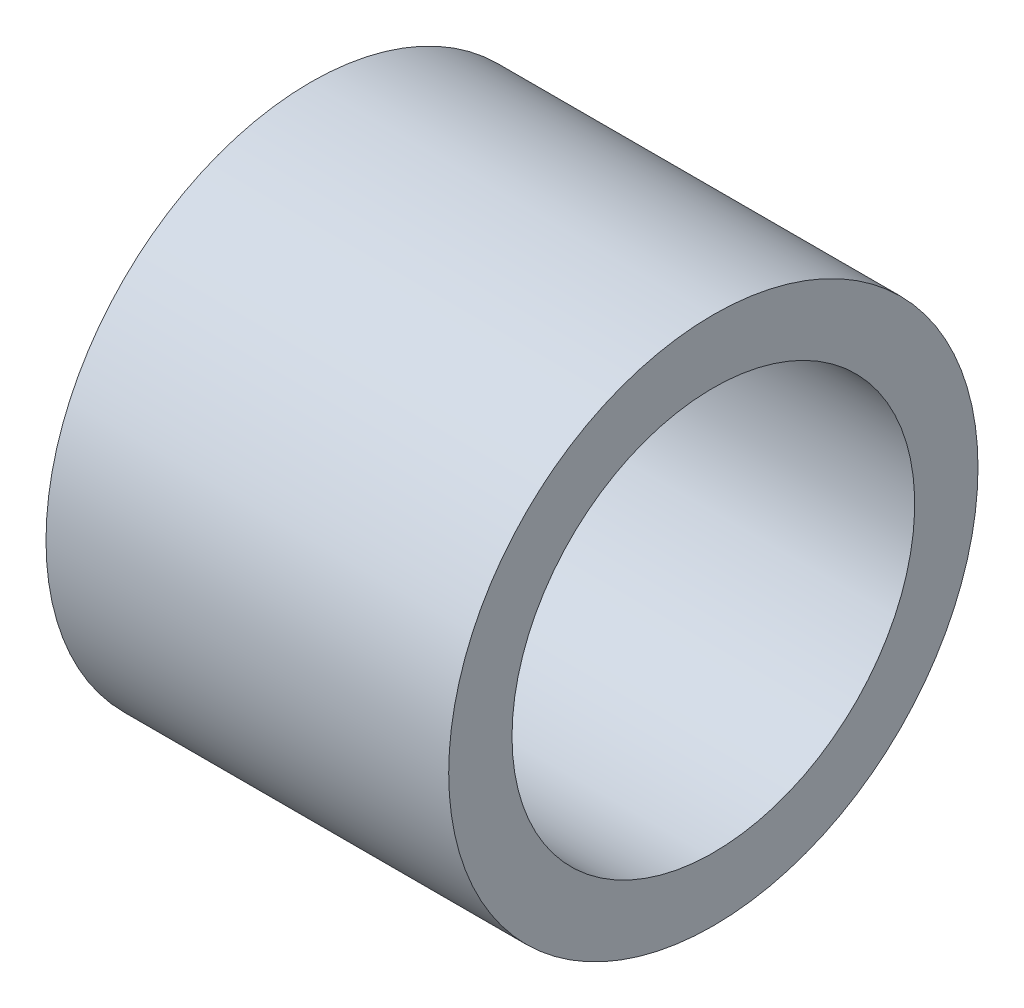
from build123d import *

# Parameters (mm, degrees)
SKETCH1_R           = 12.52
SKETCH1_R_2         = 9.525
BOSS_EXTRUDE1_DEPTH = 9.525


with BuildPart() as part:
    # Sketch1 → Boss-Extrude1 (new, symmetric)
    with BuildSketch(Plane(origin=(0, 0, 0), x_dir=(0, 0, -1), z_dir=(1, 0, 0))):
        with Locations(Location((0, 0, 0), (0, 0, 180))):
            Circle(SKETCH1_R)
        with Locations(Location((0, 0, 0), (0, 0, 180))):
            Circle(SKETCH1_R_2, mode=Mode.SUBTRACT)
    extrude(amount=BOSS_EXTRUDE1_DEPTH, both=True)


solid = part.part
